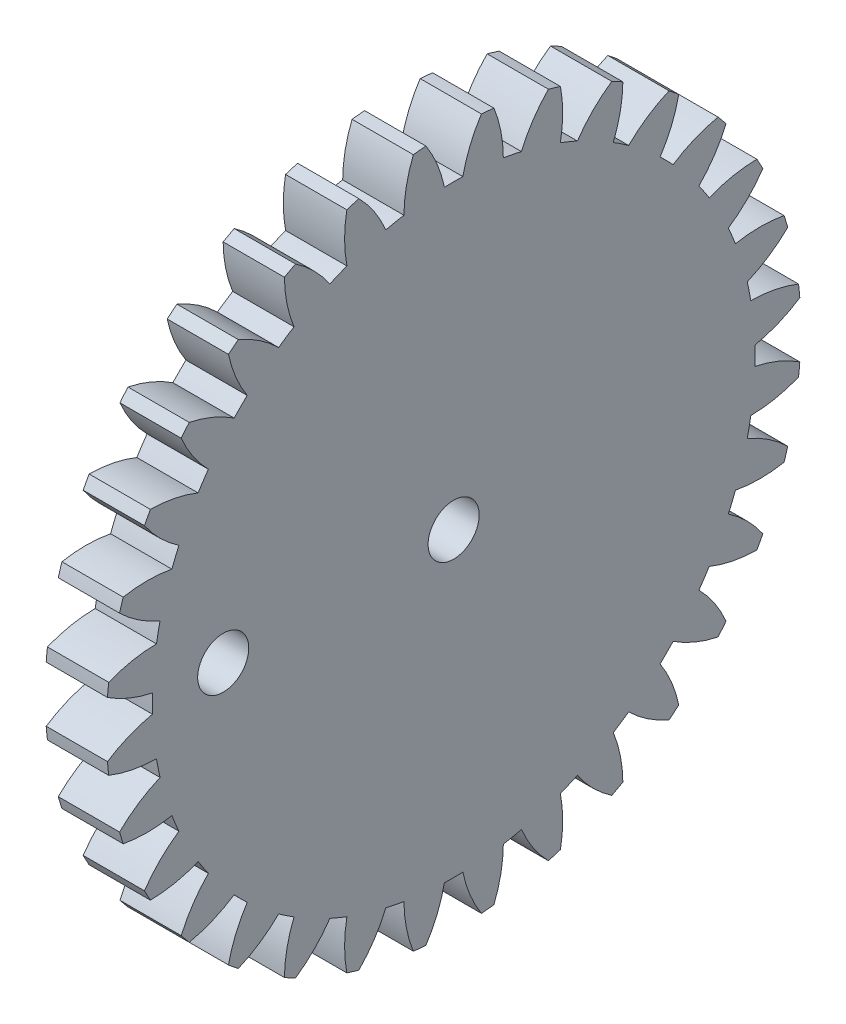
from build123d import *

# Parameters (mm, degrees)
BASPROSKE_W         = 12
BASPROSKE_H         = 68
TOOTHCUT_DEPTH      = 97.912331517
TEETHCUTS_COUNT     = 32
TEETHCUTS_ANGLE     = 348.75
BORSKE_R            = 5
BORE_DEPTH          = 50.0000508
SKETCH_2_R          = 5
CUT_EXTRUDE_3_DEPTH = 97.606823091


with BuildPart() as part:
    # BasProSke → Base-Revolve (revolve)
    with BuildSketch(Plane(origin=(0, 0, 0), x_dir=(1, 0, 0), z_dir=(0, 1, 0)), mode=Mode.PRIVATE) as base_revolve_sk:
        with Locations((6, 34)):
            Rectangle(BASPROSKE_W, BASPROSKE_H)
    revolve(base_revolve_sk.sketch.rotate(Axis((-10, 0, 0), (1, 0, 0)), 180), axis=Axis((-10, 0, 0), (1, 0, 0)))

    # TooCutSke → ToothCut (cut, through all)
    with BuildSketch(Plane(origin=(0, 0, 0), x_dir=(0, 0, -1), z_dir=(1, 0, 0))):
        with BuildLine():
            ThreePointArc((1.808411497, 58.971278169), (0, 58.999), (-1.808411497, 58.971278169))
            ThreePointArc((-1.808411497, 58.971278169), (-3.214638726, 63.560470716), (-5.452799122, 67.806504311))
            ThreePointArc((-5.452799122, 67.806504311), (0, 68.0254), (5.452799122, 67.806504311))
            ThreePointArc((5.452799122, 67.806504311), (3.214638726, 63.560470716), (1.808411497, 58.971278169))
        make_face()
    toothcut = extrude(amount=TOOTHCUT_DEPTH, mode=Mode.SUBTRACT)

    # TeethCuts: ToothCut ×32 about axis
    teethcuts_axis = Axis((-10, 0, 0), (1, 0, 0))
    for i in range(1, TEETHCUTS_COUNT):
        add(toothcut.rotate(teethcuts_axis, i * TEETHCUTS_ANGLE / (TEETHCUTS_COUNT - 1)), mode=Mode.SUBTRACT)

    # BorSke → Bore (cut, symmetric)
    with BuildSketch(Plane(origin=(0, 0, 0), x_dir=(0, 0, -1), z_dir=(1, 0, 0))):
        with Locations(Location((0, 0, 0), (0, 0, 180))):
            Circle(BORSKE_R)
    extrude(amount=BORE_DEPTH, both=True, mode=Mode.SUBTRACT)

    # 草图2 → 切除-拉伸3 (cut, through all)
    with BuildSketch(Plane(origin=(12, 0, 0), x_dir=(0, 0, -1), z_dir=(1, 0, 0))):
        with Locations((-45.119769441, 0)):
            Circle(SKETCH_2_R)
    extrude(amount=-CUT_EXTRUDE_3_DEPTH, mode=Mode.SUBTRACT)


solid = part.part
